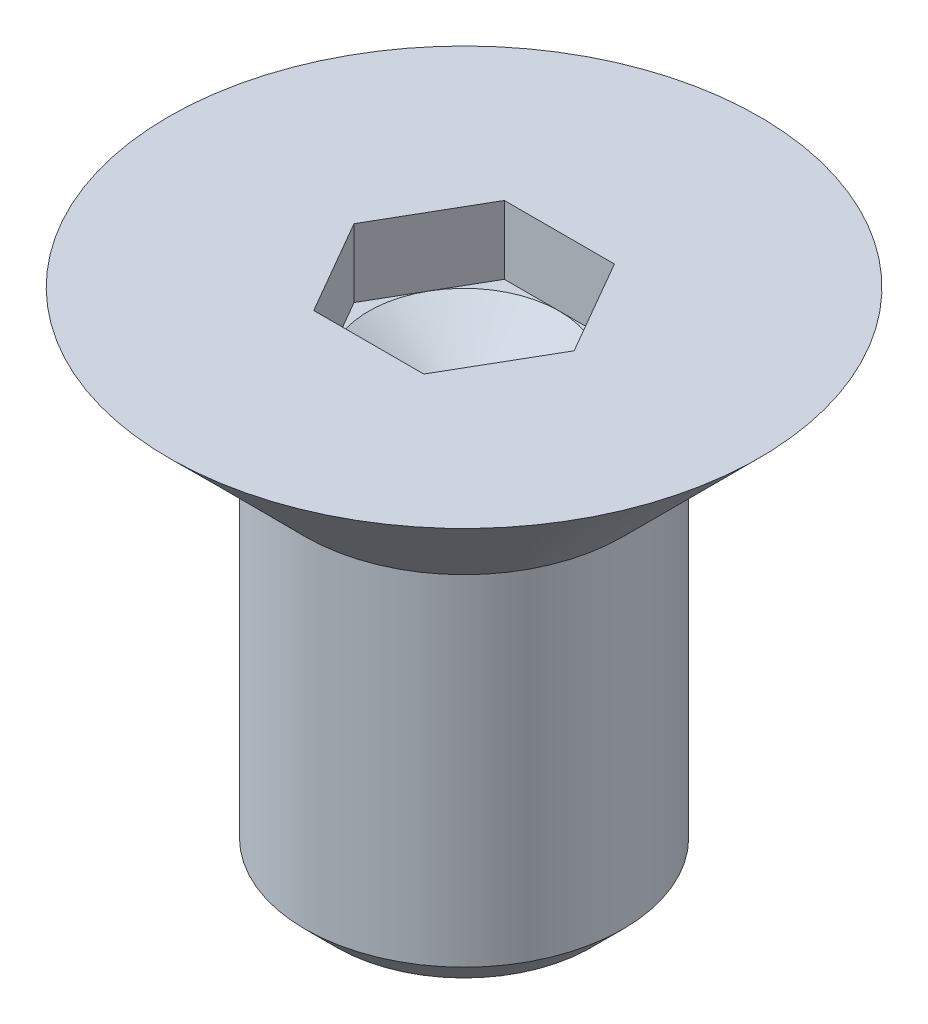
from build123d import *

# Parameters (mm, degrees)
TIGE_START              = -8
ESQUISSE1_R             = 2.5
TIGE_DEPTH              = 8
CHANFREIN_D_ENTR_E_SIZE = 0.5
HEXAGONE_DEPTH          = 1.075


with BuildPart() as part:
    # Esquisse1 → Tige (new body)
    with BuildSketch(Plane(origin=(0, 0, 0), x_dir=(1, 0, 0), z_dir=(0, 1, 0)).offset(TIGE_START)):
        with Locations(Location((0, 0, 0), (0, 0, 270))):
            Circle(ESQUISSE1_R)
    extrude(amount=TIGE_DEPTH)

    # Chanfrein d'entrée
    chanfrein_d_entr_e_edges = [part.edges().sort_by_distance(p)[0] for p in [
        (0, -8, -2.5),
    ]]
    chamfer(chanfrein_d_entr_e_edges, length=CHANFREIN_D_ENTR_E_SIZE)

    # Esquisse2 → Tête (revolve)
    with BuildSketch(Plane.XY, mode=Mode.PRIVATE) as t_te_sk:
        Polygon((0, 0), (4.65, 0), (2.5, -2.15), (0, -2.15), align=None)
    revolve(t_te_sk.sketch.rotate(Axis((0, 0, 0), (0, -1, 0)), 90), axis=Axis((0, 0, 0), (0, -1, 0)))

    # Esquisse3 → Perçage (revolve, cut)
    with BuildSketch(Plane.XY, mode=Mode.PRIVATE) as per_age_sk:
        Polygon((1.5, 0), (1.5, -1.075), (0, -1.941025404), (0, 0), align=None)
    revolve(per_age_sk.sketch.rotate(Axis((0, 0, 0), (0, -1, 0)), 90), axis=Axis((0, 0, 0), (0, -1, 0)), mode=Mode.SUBTRACT)

    # Esquisse5 → Hexagone (cut)
    with BuildSketch(Plane(origin=(0, 0, 0), x_dir=(1, 0, 0), z_dir=(0, 1, 0))):
        Polygon((0.866025404, 1.5), (-0.866025404, 1.5), (-1.732050808, 0), (-0.866025404, -1.5), (0.866025404, -1.5), (1.732050808, 0), align=None)
    extrude(amount=-HEXAGONE_DEPTH, mode=Mode.SUBTRACT)


solid = part.part
